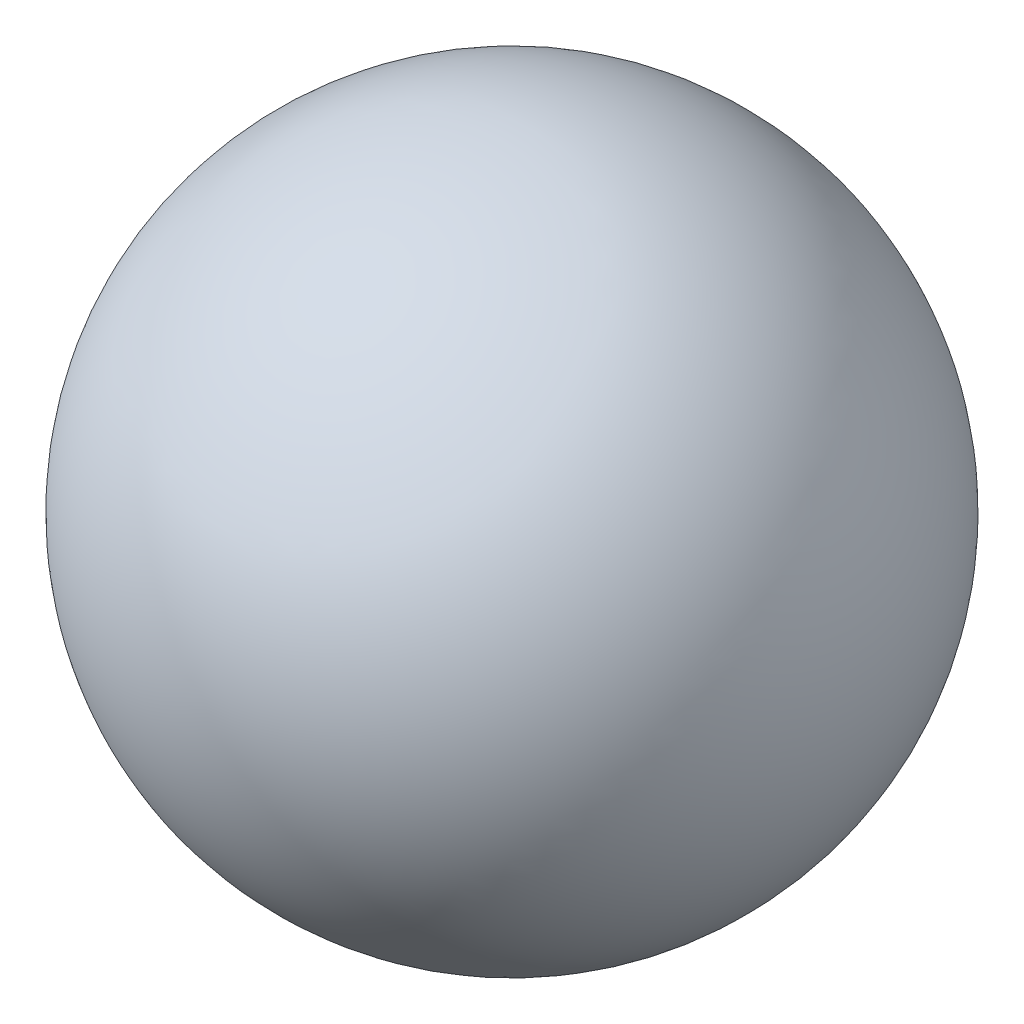
from build123d import *


with BuildPart() as part:
    # 草图1 → 旋转1 (revolve)
    with BuildSketch(Plane(origin=(0, 0, 0), x_dir=(1, 0, 0), z_dir=(0, 1, 0))):
        with BuildLine():
            Line((0, 5.1), (0, -5.1))
            ThreePointArc((0, -5.1), (5.1, 0), (0, 5.1))
        make_face()
    revolve(axis=Axis((0, 0, -5.1), (0, 0, 1)))


solid = part.part
